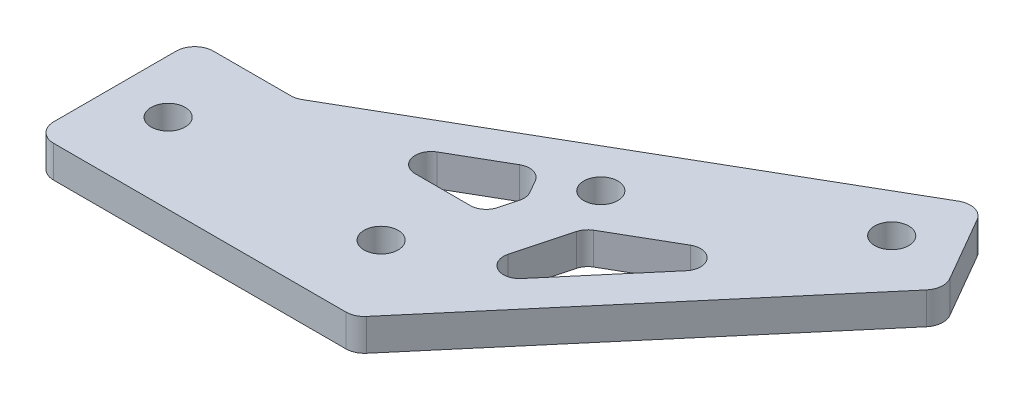
from build123d import *

# Parameters (mm, degrees)
SKETCH_2_R          = 1.5999999999999899
SKETCH_2_R_2        = 1.6000000000000019
SKETCH_2_R_3        = 1.600000000000012
SKETCH_2_R_4        = 1.5999999999999999
EXTRUDE_1_DEPTH     = 1.5
CUT_EXTRUDE_1_DEPTH = 3
FILLET_1_R          = 1
FILLET_2_R          = 1.75
MOVE_FACE_1_BY      = 0.5
MOVE_FACE_1_2_BY    = 0.5
MOVE_FACE_1_3_BY    = 0.5
MOVE_FACE_1_4_BY    = 0.5
MOVE_FACE_1_5_BY    = 0.5
MOVE_FACE_1_6_BY    = 0.5
MOVE_FACE_1_7_BY    = 0.5
MOVE_FACE_1_8_BY    = 0.5
MOVE_FACE_1_9_BY    = 0.5
MOVE_FACE_1_10_BY   = 0.5
MOVE_FACE_1_11_BY   = 0.5
MOVE_FACE_1_12_BY   = 0.5
MOVE_FACE_1_13_BY   = 0.5
MOVE_FACE_1_14_BY   = 0.5


with BuildPart() as part:
    # ｽｹｯﾁ2 → ﾎﾞｽ - 押し出し1 (new, symmetric)
    with BuildSketch(Plane(origin=(0, 0, 0), x_dir=(1, 0, 0), z_dir=(0, 1, 0))):
        Polygon((24.47000000000005, 8.660254037844277), (9.470000000000297, 1.73e-15), (0, 0), (0, -14.999999999999998), (30.000000000000004, -14.999999999999995), (55.450762113533145, 15.000000000000043), (50.450762113533166, 23.66025403784434), align=None)
        with Locations(Location((48.62063509461097, 16.830127018922173, 0), (0, 0, 270))):
            Circle(SKETCH_2_R, mode=Mode.SUBTRACT)
        with Locations(Location((25, -7.5, 0), (0, 0, 270))):
            Circle(SKETCH_2_R_2, mode=Mode.SUBTRACT)
        with Locations(Location((31.300127018922208, 6.830127018922147, 0), (0, 0, 270))):
            Circle(SKETCH_2_R_3, mode=Mode.SUBTRACT)
        with Locations(Location((5, -7.5, 0), (0, 0, 270))):
            Circle(SKETCH_2_R_4, mode=Mode.SUBTRACT)
    extrude(amount=EXTRUDE_1_DEPTH, both=True)

    # ｽｹｯﾁ3 → ｶｯﾄ - 押し出し1 (cut)
    with BuildSketch(Plane(origin=(0, 1.5, 0), x_dir=(1, 0, 0), z_dir=(0, 1, 0))):
        Polygon((26.470000000000045, 5.196152422706529), (17.470000000000258, -3.55e-15), (27.140628594077313, 0), (27.879009742330265, 2.755675960631065), align=None)
        Polygon((33.35228567653781, 0), (37.47986861759486, 0), (45.16947255557436, 9.064094706096034), (34.06279326771847, 2.651650429449568), align=None)
        Polygon((31.446764780347493, -7.111500799466448), (37.47986861759486, 3.55e-15), (33.35228567653781, 0), align=None)
    extrude(amount=-CUT_EXTRUDE_1_DEPTH, mode=Mode.SUBTRACT)

    # ﾌｨﾚｯﾄ1
    fillet_1_edges = [part.edges().sort_by_distance(p)[0] for p in [
        (27.87900974233027, 0, -2.7556759606310655),
        (27.140628594077313, 0, -8.9e-16),
        (17.47000000000026, 0, 1.78e-15),
        (26.47000000000005, 0, -5.19615242270653),
        (34.06279326771847, 0, -2.6516504294495666),
        (45.16947255557436, 0, -9.064094706096032),
        (31.446764780347493, 0, 7.111500799466448),
    ]]
    fillet(fillet_1_edges, radius=FILLET_1_R)

    # ﾌｨﾚｯﾄ2
    fillet_2_edges = [part.edges().sort_by_distance(p)[0] for p in [
        (50.450762113533166, 0, -23.66025403784434),
        (55.450762113533145, 0, -15.000000000000043),
        (30.000000000000004, 0, 14.999999999999995),
        (0, 0, 14.999999999999998),
        (0, 0, 0),
        (9.470000000000297, 0, -1.73e-15),
    ]]
    fillet(fillet_2_edges, radius=FILLET_2_R)

    # Move Face 1: a face moved inward by 0.5
    extrude(part.faces().sort_by_distance((33.277523818, 0, 0.279015055))[0], amount=MOVE_FACE_1_BY, dir=(-0.965925826, 0, -0.258819045), mode=Mode.SUBTRACT)

    # Move Face 1 2: a curved face moved inward by 0.5
    add(Solid.thicken(part.faces().sort_by_distance((33.10124082, 0, 3.954158856))[0], -MOVE_FACE_1_2_BY), mode=Mode.SUBTRACT)

    # Move Face 1 3: a face moved inward by 0.5
    extrude(part.faces().sort_by_distance((37.884808697, 0, -0.477321752))[0], amount=MOVE_FACE_1_3_BY, dir=(0.762556575, 0, 0.646921533), mode=Mode.SUBTRACT)

    # Move Face 1 4: a curved face moved inward by 0.5
    add(Solid.thicken(part.faces().sort_by_distance((41.44689767, 0, -5.957600166))[0], -MOVE_FACE_1_4_BY), mode=Mode.SUBTRACT)

    # Move Face 1 5: a face moved inward by 0.5
    extrude(part.faces().sort_by_distance((37.300315213, 0, -4.520834596))[0], amount=MOVE_FACE_1_5_BY, dir=(-0.5, 0, -0.866025404), mode=Mode.SUBTRACT)

    # Move Face 1 6: a curved face moved inward by 0.5
    add(Solid.thicken(part.faces().sort_by_distance((34.128159395, 0, -2.601493236))[0], -MOVE_FACE_1_6_BY), mode=Mode.SUBTRACT)

    # Move Face 1 7: a curved face moved inward by 0.5
    add(Solid.thicken(part.faces().sort_by_distance((20.236124981, 0, -0.741180955))[0], -MOVE_FACE_1_7_BY), mode=Mode.SUBTRACT)

    # Move Face 1 8: a face moved inward by 0.5
    extrude(part.faces().sort_by_distance((23.787676207, 0, 0))[0], amount=MOVE_FACE_1_8_BY, dir=(0, 0, 1), mode=Mode.SUBTRACT)

    # Move Face 1 9: a curved face moved inward by 0.5
    add(Solid.thicken(part.faces().sort_by_distance((26.982063035, 0, -0.20664666))[0], -MOVE_FACE_1_9_BY), mode=Mode.SUBTRACT)

    # Move Face 1 10: a face moved inward by 0.5
    extrude(part.faces().sort_by_distance((27.555515408, 0, -1.548378669))[0], amount=MOVE_FACE_1_10_BY, dir=(0.965925826, 0, 0.258819045), mode=Mode.SUBTRACT)

    # Move Face 1 11: a curved face moved inward by 0.5
    add(Solid.thicken(part.faces().sort_by_distance((27.797322419, 0, -2.74492162))[0], -MOVE_FACE_1_11_BY), mode=Mode.SUBTRACT)

    # Move Face 1 12: a face moved inward by 0.5
    extrude(part.faces().sort_by_distance((27.320951481, 0, -3.722261224))[0], amount=MOVE_FACE_1_12_BY, dir=(0.866025404, 0, -0.5), mode=Mode.SUBTRACT)

    # Move Face 1 13: a curved face moved inward by 0.5
    add(Solid.thicken(part.faces().sort_by_distance((26.362793641, 0, -4.796052845))[0], -MOVE_FACE_1_13_BY), mode=Mode.SUBTRACT)

    # Move Face 1 14: a face moved inward by 0.5
    extrude(part.faces().sort_by_distance((23.153012702, 0, -3.281088913))[0], amount=MOVE_FACE_1_14_BY, dir=(-0.5, 0, -0.866025404), mode=Mode.SUBTRACT)


solid = part.part
